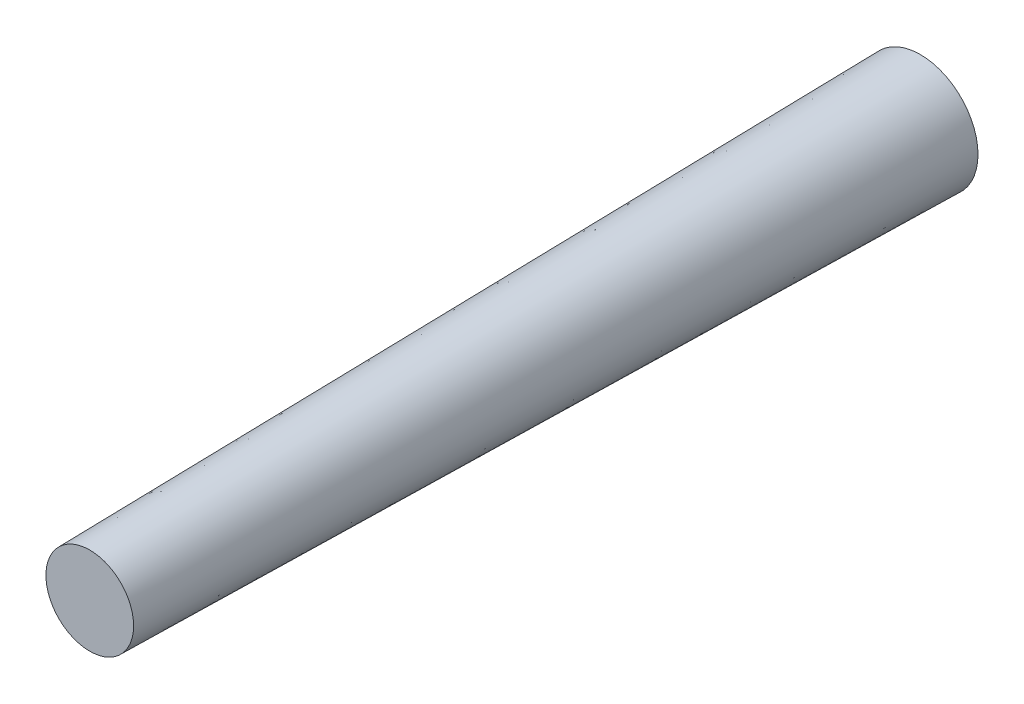
from build123d import *

# Parameters (mm, degrees)
SKETCH2_R           = 2.5
BOSS_EXTRUDE1_DEPTH = 36
BOSS_EXTRUDE1_TAPER = 0.954


with BuildPart() as part:
    # Sketch2 → Boss-Extrude1 (new body)
    with BuildSketch(Plane.XY):
        Circle(SKETCH2_R)
    extrude(amount=BOSS_EXTRUDE1_DEPTH, taper=BOSS_EXTRUDE1_TAPER)


solid = part.part
